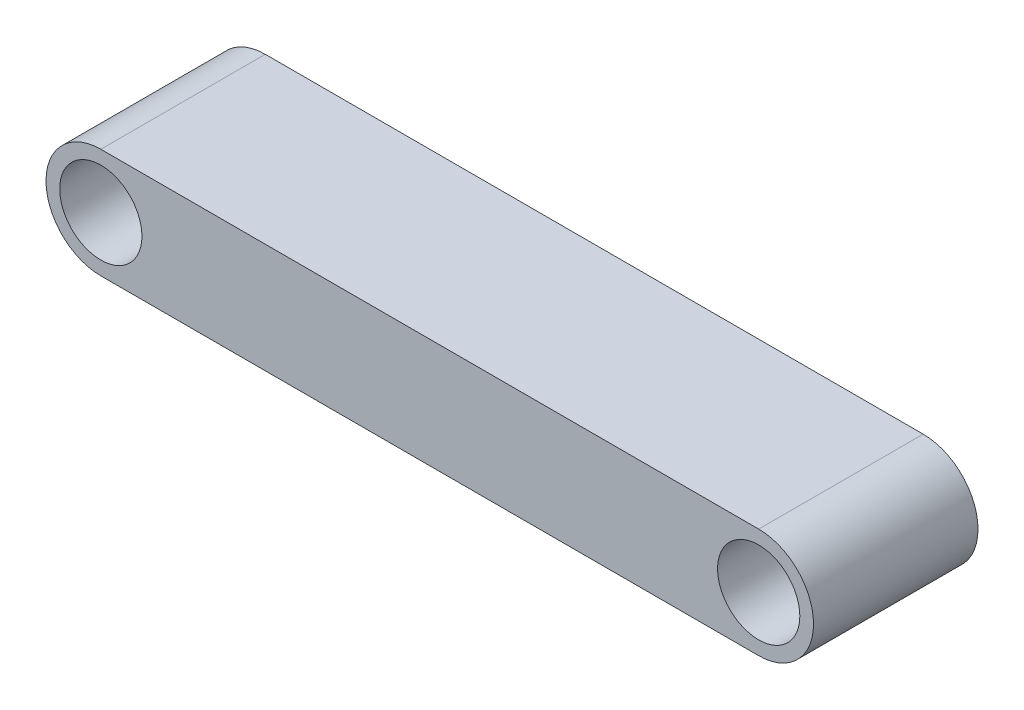
from build123d import *

# Parameters (mm, degrees)
SKETCH_1_R      = 1.5
EXTRUDE_1_DEPTH = 6


with BuildPart() as part:
    # 草图1 → 凸台-拉伸1 (new body)
    with BuildSketch(Plane.XY):
        with BuildLine():
            Line((0, -2), (24, -2))
            ThreePointArc((24, -2), (26, 0), (24, 2))
            Line((24, 2), (0, 2))
            ThreePointArc((0, 2), (-2, 0), (0, -2))
        make_face()
        Circle(SKETCH_1_R, mode=Mode.SUBTRACT)
        with Locations((24, 0)):
            Circle(SKETCH_1_R, mode=Mode.SUBTRACT)
    extrude(amount=EXTRUDE_1_DEPTH)


solid = part.part
